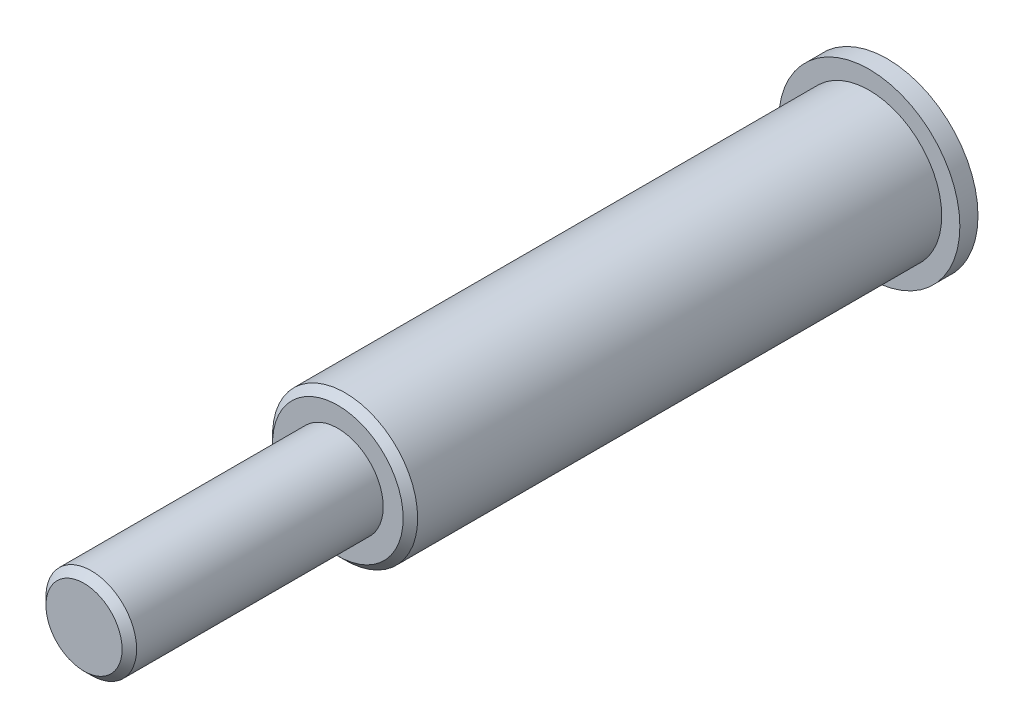
from build123d import *

# Parameters (mm, degrees)
SKETCH1_R           = 4
BOSS_EXTRUDE1_DEPTH = 29.3
SKETCH5_R           = 2.5
BOSS_EXTRUDE4_DEPTH = 14
SKETCH6_R           = 5
BOSS_EXTRUDE5_DEPTH = 1
CHAMFER1_SIZE       = 0.4


with BuildPart() as part:
    # Sketch1 → Boss-Extrude1 (new body)
    with BuildSketch(Plane.XY):
        Circle(SKETCH1_R)
    extrude(amount=BOSS_EXTRUDE1_DEPTH)

    # Sketch5 → Boss-Extrude4 (add)
    with BuildSketch(Plane.XY.offset(29.3)):
        Circle(SKETCH5_R)
    extrude(amount=BOSS_EXTRUDE4_DEPTH)

    # Sketch6 → Boss-Extrude5 (add)
    with BuildSketch(Plane(origin=(0, 0, 0), x_dir=(-1, 0, 0), z_dir=(0, 0, -1))):
        Circle(SKETCH6_R)
    extrude(amount=BOSS_EXTRUDE5_DEPTH)

    # Chamfer1
    chamfer1_edges = [part.edges().sort_by_distance(p)[0] for p in [
        (-4, 0, 29.3),
        (-2.5, 0, 43.3),
    ]]
    chamfer(chamfer1_edges, length=CHAMFER1_SIZE)


solid = part.part
